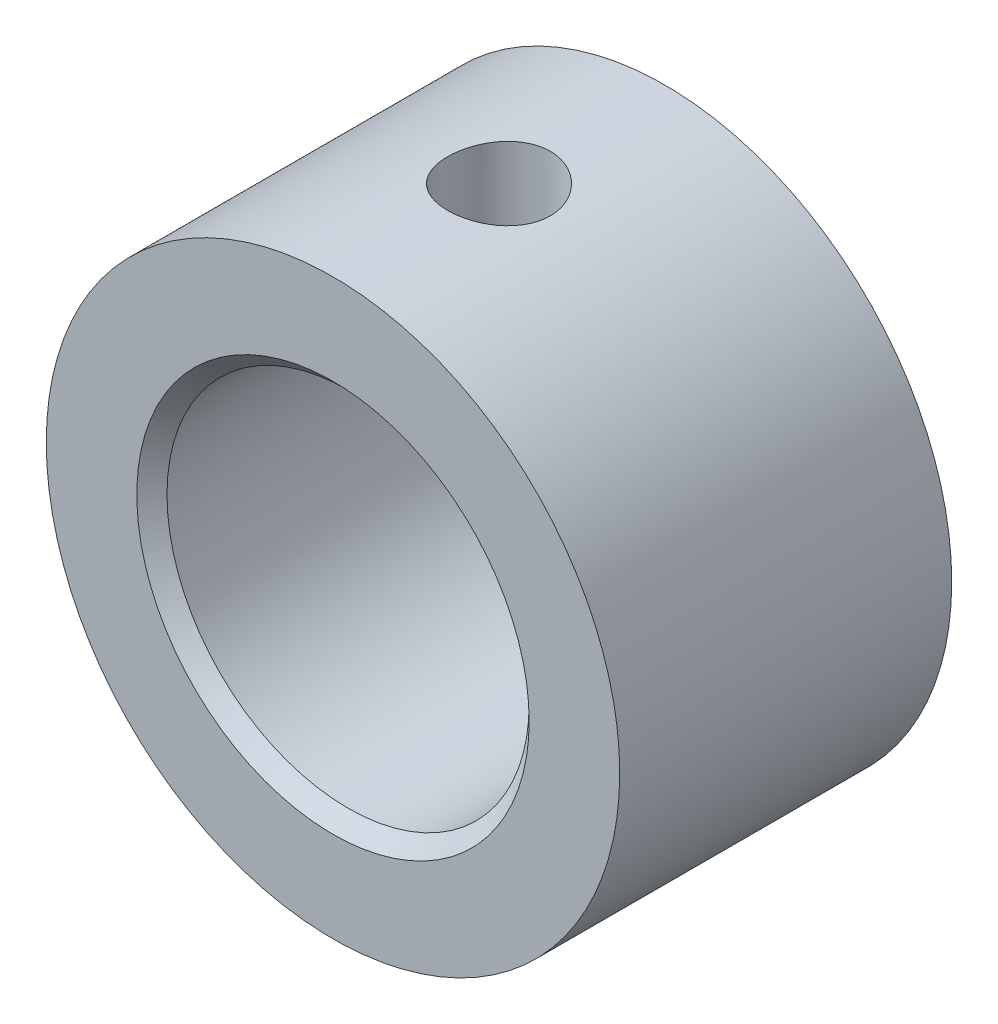
from build123d import *

# Parameters (mm, degrees)
SKETCH_1_R      = 19
SKETCH_1_R_2    = 12
EXTRUDE_1_DEPTH = 11
CHAMFER_1_SIZE  = 1
SKETCH_3_W      = 3.4
SKETCH_3_H      = 19


with BuildPart() as part:
    # 草图1 → 凸台-拉伸1 (new, symmetric)
    with BuildSketch(Plane.XY):
        Circle(SKETCH_1_R)
        Circle(SKETCH_1_R_2, mode=Mode.SUBTRACT)
    extrude(amount=EXTRUDE_1_DEPTH, both=True)

    # 倒角1
    chamfer_1_edges = [part.edges().sort_by_distance(p)[0] for p in [
        (-12, 0, -11),
        (-12, 0, 11),
    ]]
    chamfer(chamfer_1_edges, length=CHAMFER_1_SIZE)

    # 草图3 → M8 螺纹孔1 (revolve, cut)
    with BuildSketch(Plane(origin=(0, 0, 0), x_dir=(0, 0, -1), z_dir=(1, 0, 0))):
        with Locations((1.7, 9.5)):
            Rectangle(SKETCH_3_W, SKETCH_3_H)
    revolve(axis=Axis((0, -6.35, 0), (0, 1, 0)), mode=Mode.SUBTRACT)


solid = part.part
